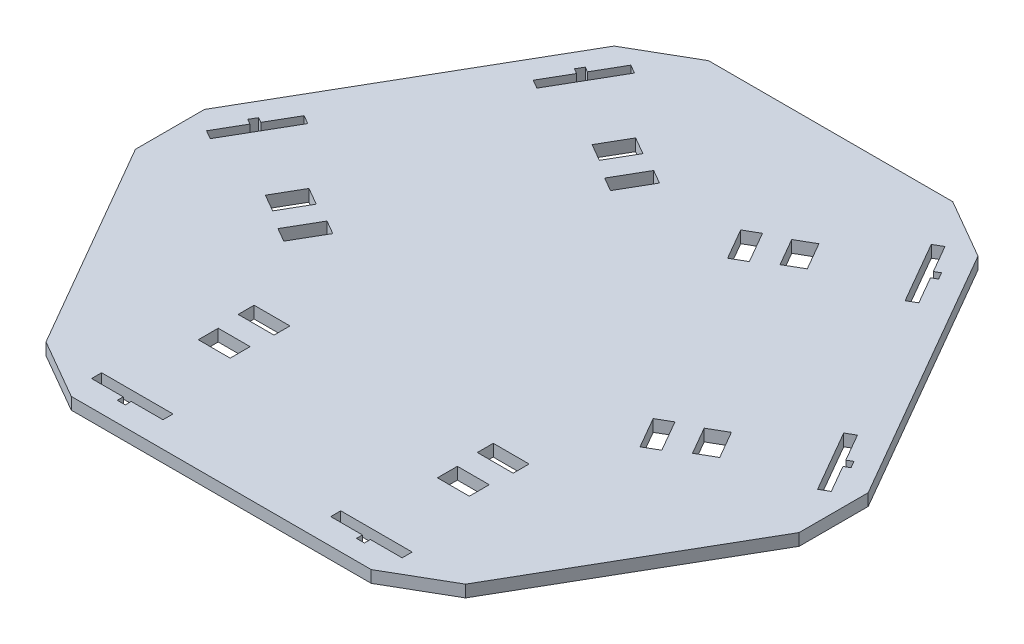
from build123d import *

# Parameters (mm, degrees)
BOSS_EXTRUDE1_DEPTH           = 3
CUT_EXTRUDE1_DEPTH            = 119.131594354
SKETCH4_W                     = 8
SKETCH4_H                     = 5
SKETCH4_W_2                   = 9
SKETCH4_H_2                   = 4
CUT_EXTRUDE2_DEPTH            = 119.131594354
CIRPATTERN1_COUNT             = 3
CIRPATTERN1_COPY_1_DEPTH      = 119.131594354
CIRPATTERN1_COPY_2_DEPTH      = 119.131594354
CIRPATTERN1_COPY_3_SKETCH_W   = 8
CIRPATTERN1_COPY_3_SKETCH_H   = 5
CIRPATTERN1_COPY_3_SKETCH_W_2 = 9
CIRPATTERN1_COPY_3_SKETCH_H_2 = 4
CIRPATTERN1_COPY_3_DEPTH      = 119.131594354
CIRPATTERN1_COPY_4_SKETCH_W   = 8
CIRPATTERN1_COPY_4_SKETCH_H   = 5
CIRPATTERN1_COPY_4_SKETCH_W_2 = 9
CIRPATTERN1_COPY_4_SKETCH_H_2 = 4
CIRPATTERN1_COPY_4_DEPTH      = 119.131594354
CHAMFER1_SIZE                 = 10


with BuildPart() as part:
    # Sketch1 → Boss-Extrude1 (new body)
    with BuildSketch(Plane(origin=(0, 0, 0), x_dir=(1, 0, 0), z_dir=(0, 1, 0))):
        Polygon((-40.639997478, 78.456126624), (40.640002522, 78.456126624), (88.264992433, -4.032793087), (47.625005045, -74.423333537), (-47.625, -74.423333537), (-88.264997478, -4.032793087), align=None)
    extrude(amount=BOSS_EXTRUDE1_DEPTH)

    # Sketch2 → Cut-Extrude1 (cut, through all)
    with BuildSketch(Plane(origin=(0, 3, 0), x_dir=(1, 0, 0), z_dir=(0, 1, 0))):
        Polygon((29, -68), (29, -69.5), (31, -69.5), (31, -68), (38.96, -68), (38.96, -65.48), (21.04, -65.48), (21.04, -68), align=None)
    cut_extrude1 = extrude(amount=-CUT_EXTRUDE1_DEPTH, mode=Mode.SUBTRACT)

    # Sketch4 → Cut-Extrude2 (cut, through all)
    with BuildSketch(Plane(origin=(0, 3, 0), x_dir=(1, 0, 0), z_dir=(0, 1, 0))):
        with Locations((30, -43.68)):
            Rectangle(SKETCH4_W, SKETCH4_H)
        with Locations((30, -33.68)):
            Rectangle(SKETCH4_W_2, SKETCH4_H_2)
    cut_extrude2 = extrude(amount=-CUT_EXTRUDE2_DEPTH, mode=Mode.SUBTRACT)

    # Mirror1: Cut-Extrude1, Cut-Extrude2 across plane
    add(cut_extrude1.mirror(Plane(origin=(0, 0, 0), x_dir=(0, 0, 1), z_dir=(1, 0, 0))), mode=Mode.SUBTRACT)
    add(cut_extrude2.mirror(Plane(origin=(0, 0, 0), x_dir=(0, 0, 1), z_dir=(1, 0, 0))), mode=Mode.SUBTRACT)

    # CirPattern1: Cut-Extrude1, Cut-Extrude2 ×3 about axis
    cirpattern1_axis = Axis((0, 0, 0), (0, 1, 0))
    add([cut_extrude1.rotate(cirpattern1_axis, i * 360 / CIRPATTERN1_COUNT) for i in range(1, CIRPATTERN1_COUNT)], mode=Mode.SUBTRACT)
    add([cut_extrude2.rotate(cirpattern1_axis, i * 360 / CIRPATTERN1_COUNT) for i in range(1, CIRPATTERN1_COUNT)], mode=Mode.SUBTRACT)

    # CirPattern1 copy 1 sketch → CirPattern1 copy 1 (cut, through all)
    with BuildSketch(Plane(origin=(0, 3, 0), x_dir=(0.4999999999999998, 0, 0.8660254037844387), z_dir=(0, 1, 0))):
        Polygon((29, 68), (29, 69.5), (31, 69.5), (31, 68), (38.96, 68), (38.96, 65.48), (21.04, 65.48), (21.04, 68), align=None)
    extrude(amount=-CIRPATTERN1_COPY_1_DEPTH, mode=Mode.SUBTRACT)

    # CirPattern1 copy 2 sketch → CirPattern1 copy 2 (cut, through all)
    with BuildSketch(Plane(origin=(0, 3, 0), x_dir=(0.5000000000000004, 0, -0.8660254037844384), z_dir=(0, 1, 0))):
        Polygon((29, 68), (29, 69.5), (31, 69.5), (31, 68), (38.96, 68), (38.96, 65.48), (21.04, 65.48), (21.04, 68), align=None)
    extrude(amount=-CIRPATTERN1_COPY_2_DEPTH, mode=Mode.SUBTRACT)

    # CirPattern1 copy 3 sketch → CirPattern1 copy 3 (cut, through all)
    with BuildSketch(Plane(origin=(0, 3, 0), x_dir=(0.4999999999999998, 0, 0.8660254037844387), z_dir=(0, 1, 0))):
        with Locations((30, 43.68)):
            Rectangle(CIRPATTERN1_COPY_3_SKETCH_W, CIRPATTERN1_COPY_3_SKETCH_H)
        with Locations((30, 33.68)):
            Rectangle(CIRPATTERN1_COPY_3_SKETCH_W_2, CIRPATTERN1_COPY_3_SKETCH_H_2)
    extrude(amount=-CIRPATTERN1_COPY_3_DEPTH, mode=Mode.SUBTRACT)

    # CirPattern1 copy 4 sketch → CirPattern1 copy 4 (cut, through all)
    with BuildSketch(Plane(origin=(0, 3, 0), x_dir=(0.5000000000000004, 0, -0.8660254037844384), z_dir=(0, 1, 0))):
        with Locations((30, 43.68)):
            Rectangle(CIRPATTERN1_COPY_4_SKETCH_W, CIRPATTERN1_COPY_4_SKETCH_H)
        with Locations((30, 33.68)):
            Rectangle(CIRPATTERN1_COPY_4_SKETCH_W_2, CIRPATTERN1_COPY_4_SKETCH_H_2)
    extrude(amount=-CIRPATTERN1_COPY_4_DEPTH, mode=Mode.SUBTRACT)

    # Chamfer1
    chamfer1_edges = [part.edges().sort_by_distance(p)[0] for p in [
        (-40.639997478, 1.5, -78.456126624),
        (40.640002522, 1.5, -78.456126624),
        (88.264992433, 1.5, 4.032793087),
        (47.625005045, 1.5, 74.423333537),
        (-47.625, 1.5, 74.423333537),
        (-88.264997478, 1.5, 4.032793087),
    ]]
    chamfer(chamfer1_edges, length=CHAMFER1_SIZE)


solid = part.part
